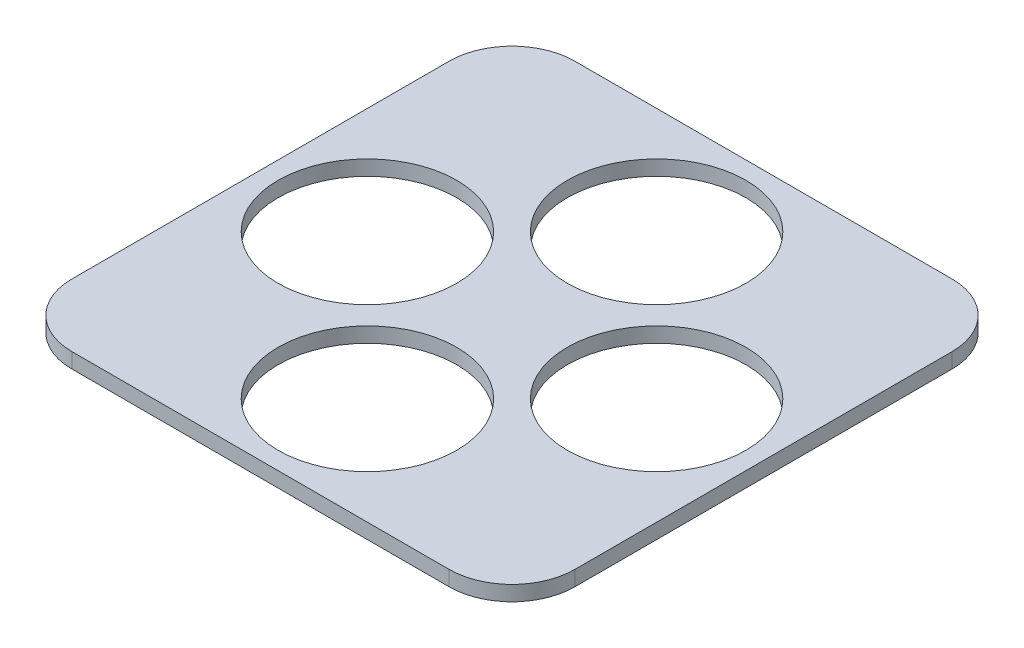
from build123d import *

# Parameters (mm, degrees)
ESBO_O1_R                = 7.1
RESSALTO_EXTRUS_O1_DEPTH = 1.2


with BuildPart() as part:
    # Esboço1 → Ressalto-extrusão1 (new body)
    with BuildSketch(Plane(origin=(0, 0, 0), x_dir=(1, 0, 0), z_dir=(0, 1, 0))):
        with BuildLine():
            Line((-15, -20), (15, -20))
            ThreePointArc((15, -20), (18.535533906, -18.535533906), (20, -15))
            Line((20, -15), (20, 15))
            ThreePointArc((20, 15), (18.535533906, 18.535533906), (15, 20))
            Line((15, 20), (-15, 20))
            ThreePointArc((-15, 20), (-18.535533906, 18.535533906), (-20, 15))
            Line((-20, 15), (-20, -15))
            ThreePointArc((-20, -15), (-18.535533906, -18.535533906), (-15, -20))
        make_face()
        with Locations(Location((0, 11.5, 0), (0, 0, 270))):
            Circle(ESBO_O1_R, mode=Mode.SUBTRACT)
        with Locations(Location((11.5, 0, 0), (0, 0, 270))):
            Circle(ESBO_O1_R, mode=Mode.SUBTRACT)
        with Locations(Location((0, -11.5, 0), (0, 0, 270))):
            Circle(ESBO_O1_R, mode=Mode.SUBTRACT)
        with Locations(Location((-11.5, 0, 0), (0, 0, 270))):
            Circle(ESBO_O1_R, mode=Mode.SUBTRACT)
    extrude(amount=RESSALTO_EXTRUS_O1_DEPTH)


solid = part.part
